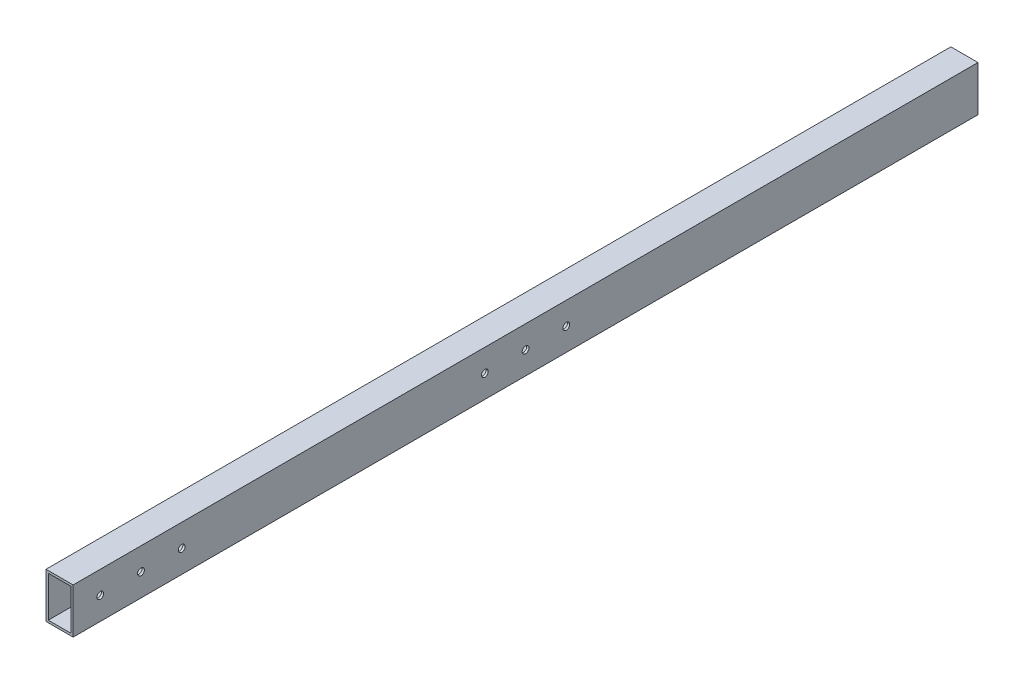
from build123d import *

# Parameters (mm, degrees)
SKETCH1_W           = 12
SKETCH1_H           = 20
SKETCH1_W_2         = 10
SKETCH1_H_2         = 18
BOSS_EXTRUDE1_DEPTH = 400
SKETCH2_R           = 1.5
CUT_EXTRUDE1_DEPTH  = 200


with BuildPart() as part:
    # Sketch1 → Boss-Extrude1 (new body)
    with BuildSketch(Plane.XY):
        Rectangle(SKETCH1_W, SKETCH1_H)
        Rectangle(SKETCH1_W_2, SKETCH1_H_2, mode=Mode.SUBTRACT)
    extrude(amount=BOSS_EXTRUDE1_DEPTH)

    # Sketch2 → Cut-Extrude1 (cut)
    with BuildSketch(Plane(origin=(6, 0, 0), x_dir=(0, 0, -1), z_dir=(1, 0, 0))):
        with Locations(Location((-200, 0, 0), (0, 0, 90))):
            Circle(SKETCH2_R)
        with Locations(Location((-182, 0, 0), (0, 0, 90))):
            Circle(SKETCH2_R)
        with Locations(Location((-218, 0, 0), (0, 0, 90))):
            Circle(SKETCH2_R)
        with Locations(Location((-370, 0, 0), (0, 0, 90))):
            Circle(SKETCH2_R)
        with Locations(Location((-388, 0, 0), (0, 0, 90))):
            Circle(SKETCH2_R)
        with Locations(Location((-352, 0, 0), (0, 0, 90))):
            Circle(SKETCH2_R)
    extrude(amount=-CUT_EXTRUDE1_DEPTH, mode=Mode.SUBTRACT)


solid = part.part
